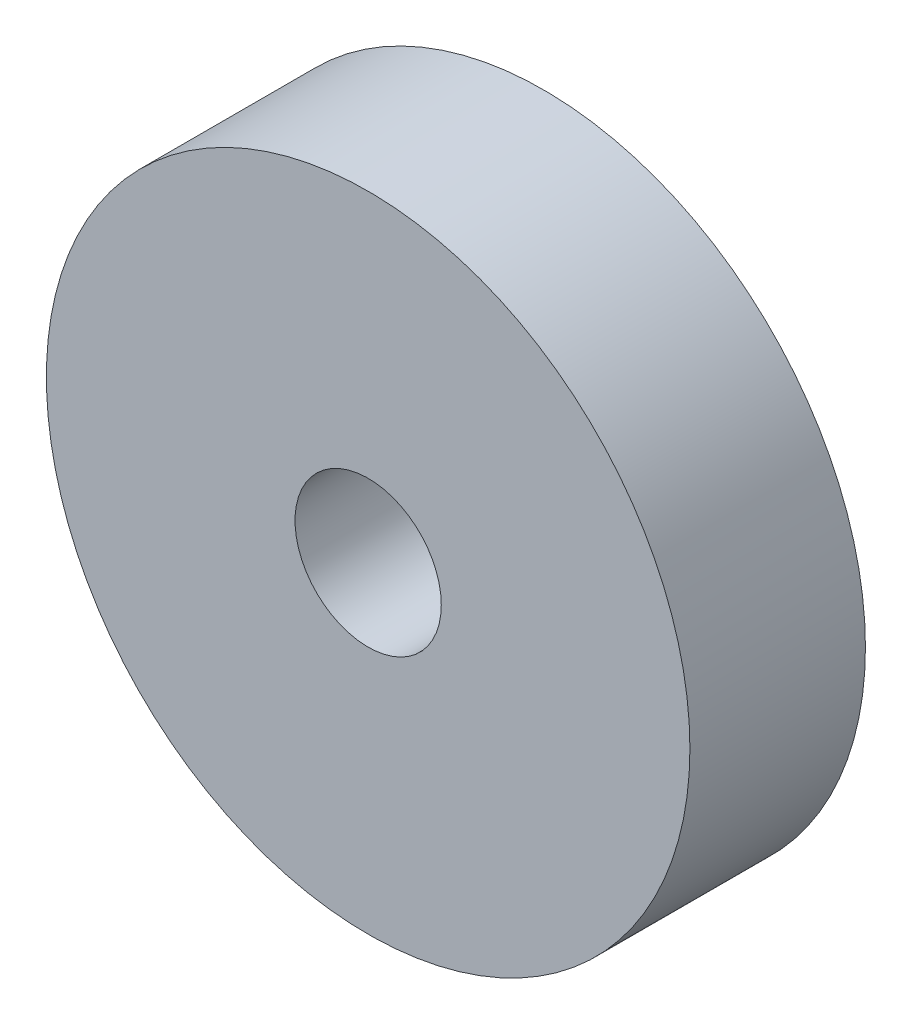
from build123d import *

# Parameters (mm, degrees)
SKETCH_1_R      = 5.5
SKETCH_1_R_2    = 1.25
EXTRUDE_1_DEPTH = 3


with BuildPart() as part:
    # 草圖1 → 填料-伸長1 (new body)
    with BuildSketch(Plane.XY):
        Circle(SKETCH_1_R)
        Circle(SKETCH_1_R_2, mode=Mode.SUBTRACT)
    extrude(amount=EXTRUDE_1_DEPTH)


solid = part.part
